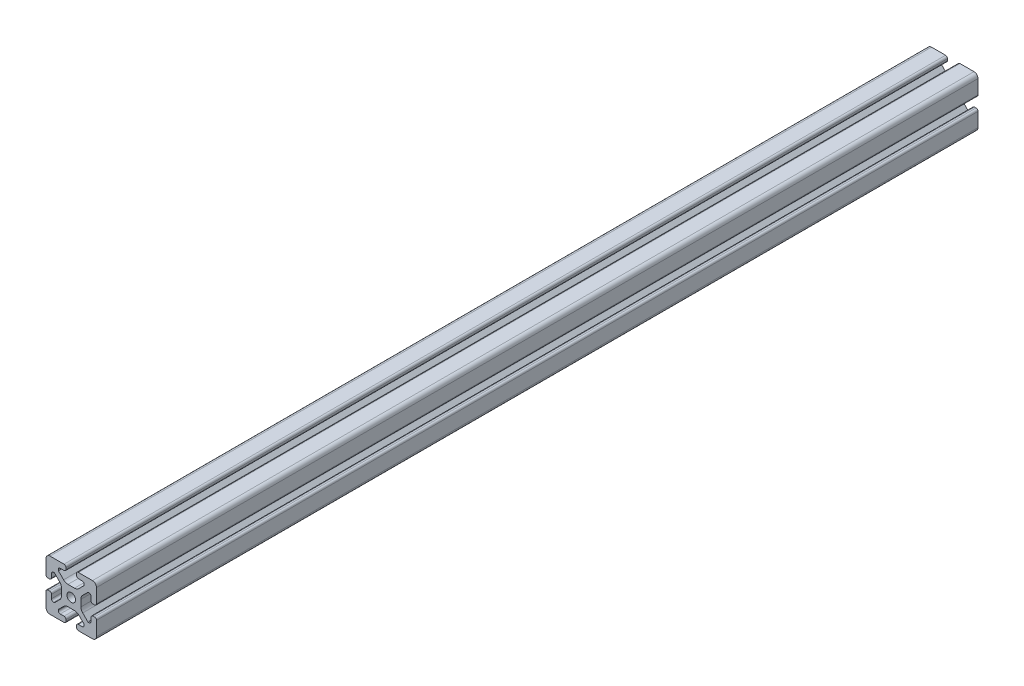
from build123d import *

# Parameters (mm, degrees)
SKETCH1_R           = 3.4
BOSS_EXTRUDE1_DEPTH = 4000
SKETCH5_W           = 697.408290135
SKETCH5_H           = 280.560400268
CUT_EXTRUDE4_DEPTH  = 3343.402


with BuildPart() as part:
    # Sketch1 → Boss-Extrude1 (new body)
    with BuildSketch(Plane(origin=(0, 0, -4000), x_dir=(-1, 0, 0), z_dir=(0, 0, -1))):
        with BuildLine():
            Line((16.83, 20), (5.69044933, 20))
            ThreePointArc((5.69044933, 20), (4.580291684, 19.540157646), (4.12044933, 18.43))
            Line((4.12044933, 18.43), (4.12044933, 17.25))
            ThreePointArc((4.12044933, 17.25), (4.580291684, 16.139842354), (5.69044933, 15.68))
            Line((5.69044933, 15.68), (8.7153995, 15.68))
            ThreePointArc((8.7153995, 15.68), (9.825557146, 15.220157646), (10.2853995, 14.11))
            Line((10.2853995, 14.11), (10.2853995, 13.654903102))
            ThreePointArc((10.2853995, 13.654903102), (10.227547945, 13.364063694), (10.062800654, 13.117501948))
            Line((10.062800654, 13.117501948), (6.055092794, 9.109794088))
            ThreePointArc((6.055092794, 9.109794088), (4.47691877, 8.055291919), (2.615335582, 7.685))
            Line((2.615335582, 7.685), (-2.615335582, 7.685))
            ThreePointArc((-2.615335582, 7.685), (-4.47691877, 8.055291919), (-6.055092794, 9.109794088))
            Line((-6.055092794, 9.109794088), (-10.062800654, 13.117501948))
            ThreePointArc((-10.062800654, 13.117501948), (-10.227547945, 13.364063694), (-10.2853995, 13.654903102))
            Line((-10.2853995, 13.654903102), (-10.2853995, 14.11))
            ThreePointArc((-10.2853995, 14.11), (-9.825557146, 15.220157646), (-8.7153995, 15.68))
            Line((-8.7153995, 15.68), (-5.69044933, 15.68))
            ThreePointArc((-5.69044933, 15.68), (-4.580291684, 16.139842354), (-4.12044933, 17.25))
            Line((-4.12044933, 17.25), (-4.12044933, 18.43))
            ThreePointArc((-4.12044933, 18.43), (-4.580291684, 19.540157646), (-5.69044933, 20))
            Line((-5.69044933, 20), (-16.83, 20))
            ThreePointArc((-16.83, 20), (-19.071528496, 19.071528496), (-20, 16.83))
            Line((-20, 16.83), (-20, 5.69044933))
            ThreePointArc((-20, 5.69044933), (-19.540157646, 4.580291684), (-18.43, 4.12044933))
            Line((-18.43, 4.12044933), (-17.25, 4.12044933))
            ThreePointArc((-17.25, 4.12044933), (-16.139842354, 4.580291684), (-15.68, 5.69044933))
            Line((-15.68, 5.69044933), (-15.68, 8.7153995))
            ThreePointArc((-15.68, 8.7153995), (-15.220157646, 9.825557146), (-14.11, 10.2853995))
            Line((-14.11, 10.2853995), (-13.654903102, 10.2853995))
            ThreePointArc((-13.654903102, 10.2853995), (-13.364063694, 10.227547945), (-13.117501948, 10.062800654))
            Line((-13.117501948, 10.062800654), (-9.109794088, 6.055092794))
            ThreePointArc((-9.109794088, 6.055092794), (-8.055291919, 4.47691877), (-7.685, 2.615335582))
            Line((-7.685, 2.615335582), (-7.685, -2.615335582))
            ThreePointArc((-7.685, -2.615335582), (-8.055291919, -4.47691877), (-9.109794088, -6.055092794))
            Line((-9.109794088, -6.055092794), (-13.117501948, -10.062800654))
            ThreePointArc((-13.117501948, -10.062800654), (-13.364063694, -10.227547945), (-13.654903102, -10.2853995))
            Line((-13.654903102, -10.2853995), (-14.11, -10.2853995))
            ThreePointArc((-14.11, -10.2853995), (-15.220157646, -9.825557146), (-15.68, -8.7153995))
            Line((-15.68, -8.7153995), (-15.68, -5.69044933))
            ThreePointArc((-15.68, -5.69044933), (-16.139842354, -4.580291684), (-17.25, -4.12044933))
            Line((-17.25, -4.12044933), (-18.43, -4.12044933))
            ThreePointArc((-18.43, -4.12044933), (-19.540157646, -4.580291684), (-20, -5.69044933))
            Line((-20, -5.69044933), (-20, -16.83))
            ThreePointArc((-20, -16.83), (-19.071528496, -19.071528496), (-16.83, -20))
            Line((-16.83, -20), (-5.69044933, -20))
            ThreePointArc((-5.69044933, -20), (-4.580291684, -19.540157646), (-4.12044933, -18.43))
            Line((-4.12044933, -18.43), (-4.12044933, -17.25))
            ThreePointArc((-4.12044933, -17.25), (-4.580291684, -16.139842354), (-5.69044933, -15.68))
            Line((-5.69044933, -15.68), (-8.7153995, -15.68))
            ThreePointArc((-8.7153995, -15.68), (-9.825557146, -15.220157646), (-10.2853995, -14.11))
            Line((-10.2853995, -14.11), (-10.2853995, -13.654903102))
            ThreePointArc((-10.2853995, -13.654903102), (-10.227547945, -13.364063694), (-10.062800654, -13.117501948))
            Line((-10.062800654, -13.117501948), (-6.055092794, -9.109794088))
            ThreePointArc((-6.055092794, -9.109794088), (-4.47691877, -8.055291919), (-2.615335582, -7.685))
            Line((-2.615335582, -7.685), (2.615335582, -7.685))
            ThreePointArc((2.615335582, -7.685), (4.47691877, -8.055291919), (6.055092794, -9.109794088))
            Line((6.055092794, -9.109794088), (10.062800654, -13.117501948))
            ThreePointArc((10.062800654, -13.117501948), (10.227547945, -13.364063694), (10.2853995, -13.654903102))
            Line((10.2853995, -13.654903102), (10.2853995, -14.11))
            ThreePointArc((10.2853995, -14.11), (9.825557146, -15.220157646), (8.7153995, -15.68))
            Line((8.7153995, -15.68), (5.69044933, -15.68))
            ThreePointArc((5.69044933, -15.68), (4.580291684, -16.139842354), (4.12044933, -17.25))
            Line((4.12044933, -17.25), (4.12044933, -18.43))
            ThreePointArc((4.12044933, -18.43), (4.580291684, -19.540157646), (5.69044933, -20))
            Line((5.69044933, -20), (16.83, -20))
            ThreePointArc((16.83, -20), (19.071528496, -19.071528496), (20, -16.83))
            Line((20, -16.83), (20, -5.69044933))
            ThreePointArc((20, -5.69044933), (19.540157646, -4.580291684), (18.43, -4.12044933))
            Line((18.43, -4.12044933), (17.25, -4.12044933))
            ThreePointArc((17.25, -4.12044933), (16.139842354, -4.580291684), (15.68, -5.69044933))
            Line((15.68, -5.69044933), (15.68, -8.7153995))
            ThreePointArc((15.68, -8.7153995), (15.220157646, -9.825557146), (14.11, -10.2853995))
            Line((14.11, -10.2853995), (13.654903102, -10.2853995))
            ThreePointArc((13.654903102, -10.2853995), (13.364063694, -10.227547945), (13.117501948, -10.062800654))
            Line((13.117501948, -10.062800654), (9.109794088, -6.055092794))
            ThreePointArc((9.109794088, -6.055092794), (8.055291919, -4.47691877), (7.685, -2.615335582))
            Line((7.685, -2.615335582), (7.685, 2.615335582))
            ThreePointArc((7.685, 2.615335582), (8.055291919, 4.47691877), (9.109794088, 6.055092794))
            Line((9.109794088, 6.055092794), (13.117501948, 10.062800654))
            ThreePointArc((13.117501948, 10.062800654), (13.364063694, 10.227547945), (13.654903102, 10.2853995))
            Line((13.654903102, 10.2853995), (14.11, 10.2853995))
            ThreePointArc((14.11, 10.2853995), (15.220157646, 9.825557146), (15.68, 8.7153995))
            Line((15.68, 8.7153995), (15.68, 5.69044933))
            ThreePointArc((15.68, 5.69044933), (16.139842354, 4.580291684), (17.25, 4.12044933))
            Line((17.25, 4.12044933), (18.43, 4.12044933))
            ThreePointArc((18.43, 4.12044933), (19.540157646, 4.580291684), (20, 5.69044933))
            Line((20, 5.69044933), (20, 16.83))
            ThreePointArc((20, 16.83), (19.071528496, 19.071528496), (16.83, 20))
        make_face()
        with Locations(Location((0, 0, 0), (0, 0, 180))):
            Circle(SKETCH1_R, mode=Mode.SUBTRACT)
    extrude(amount=-BOSS_EXTRUDE1_DEPTH)

    # Sketch5 → Cut-Extrude4 (cut)
    with BuildSketch(Plane(origin=(0, 0, -698.5), x_dir=(-1, 0, 0), z_dir=(0, 0, -1))):
        with Locations((74.343626988, -18.89908474)):
            Rectangle(SKETCH5_W, SKETCH5_H)
    extrude(amount=CUT_EXTRUDE4_DEPTH, mode=Mode.SUBTRACT)


solid = part.part
